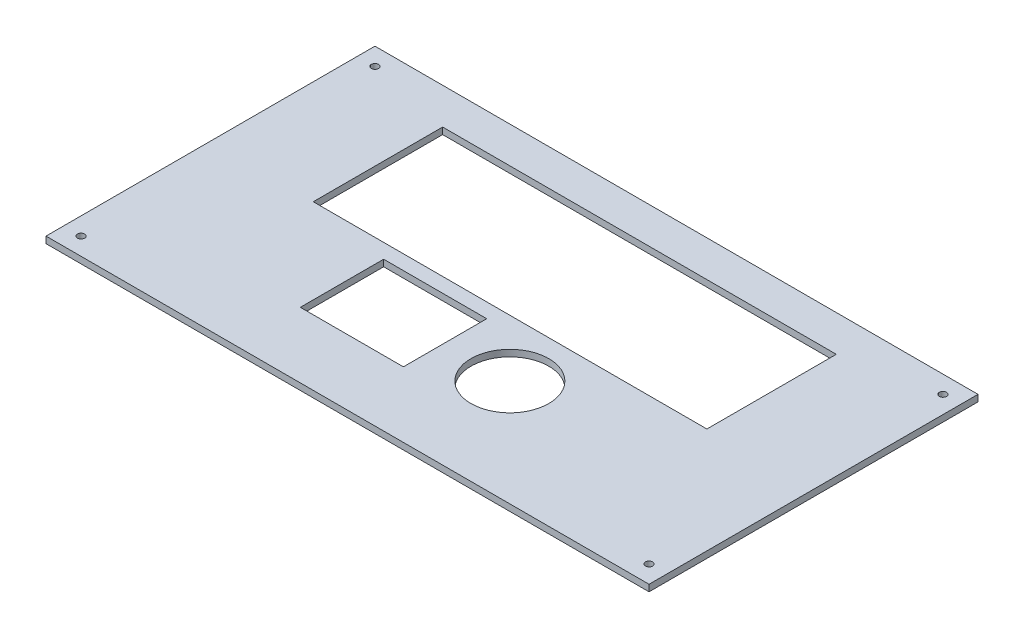
from build123d import *

# Parameters (mm, degrees)
SKIZZE1_W                       = 275
SKIZZE1_H                       = 150
SKIZZE1_R                       = 1.65
SKIZZE1_R_2                     = 17.75
SKIZZE1_W_2                     = 179.5
SKIZZE1_H_2                     = 59
SKIZZE1_W_3                     = 47
SKIZZE1_H_3                     = 38
AUFSATZ_LINEAR_AUSTRAGEN1_DEPTH = 3


with BuildPart() as part:
    # Skizze1 → Aufsatz-Linear austragen1 (new body)
    with BuildSketch(Plane(origin=(0, 0, 0), x_dir=(1, 0, 0), z_dir=(0, 1, 0))):
        Rectangle(SKIZZE1_W, SKIZZE1_H)
        with Locations(Location((-129.5, -67, 0), (0, 0, 270))):
            Circle(SKIZZE1_R, mode=Mode.SUBTRACT)
        with Locations(Location((129.5, -67, 0), (0, 0, 270))):
            Circle(SKIZZE1_R, mode=Mode.SUBTRACT)
        with Locations(Location((-129.5, 67, 0), (0, 0, 270))):
            Circle(SKIZZE1_R, mode=Mode.SUBTRACT)
        with Locations(Location((129.5, 67, 0), (0, 0, 270))):
            Circle(SKIZZE1_R, mode=Mode.SUBTRACT)
        with Locations(Location((25.525, -26.5, 0), (0, 0, 270))):
            Circle(SKIZZE1_R_2, mode=Mode.SUBTRACT)
        with Locations((-0.375, 29)):
            Rectangle(SKIZZE1_W_2, SKIZZE1_H_2, mode=Mode.SUBTRACT)
        with Locations((-27.875, -26.15)):
            Rectangle(SKIZZE1_W_3, SKIZZE1_H_3, mode=Mode.SUBTRACT)
    extrude(amount=AUFSATZ_LINEAR_AUSTRAGEN1_DEPTH)


solid = part.part
